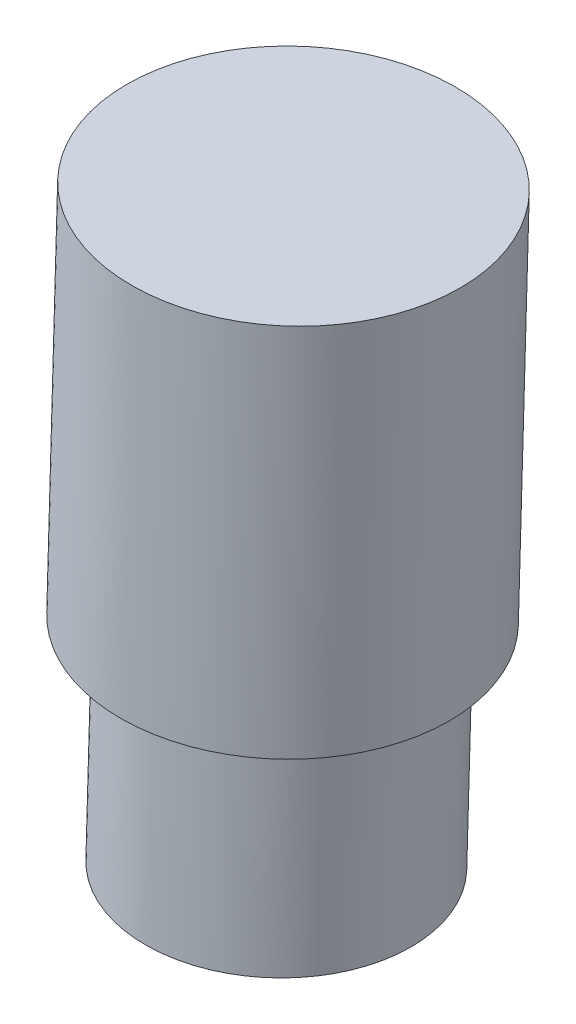
from build123d import *


with BuildPart() as part:
    # Esquisse1 → Révolution1 (revolve)
    with BuildSketch(Plane(origin=(0, 0, -182.350120167), x_dir=(-1, 0, 0), z_dir=(0, 0, -1)), mode=Mode.PRIVATE) as r_volution1_sk:
        Polygon((226.817651845, 3.589993366), (234.561745648, 3.812908136), (233.574533706, 38.10880464), (223.985821161, 37.832792274), (224.615659632, 15.952105777), (226.460278374, 16.005203373), align=None)
    revolve(r_volution1_sk.sketch.rotate(Axis((-234.568156967, 3.590177917, -182.350120167), (0.02877321495810403, 0.9995859653381368, 0)), 180), axis=Axis((-234.568156967, 3.590177917, -182.350120167), (0.02877321495810403, 0.9995859653381368, 0)))


solid = part.part
